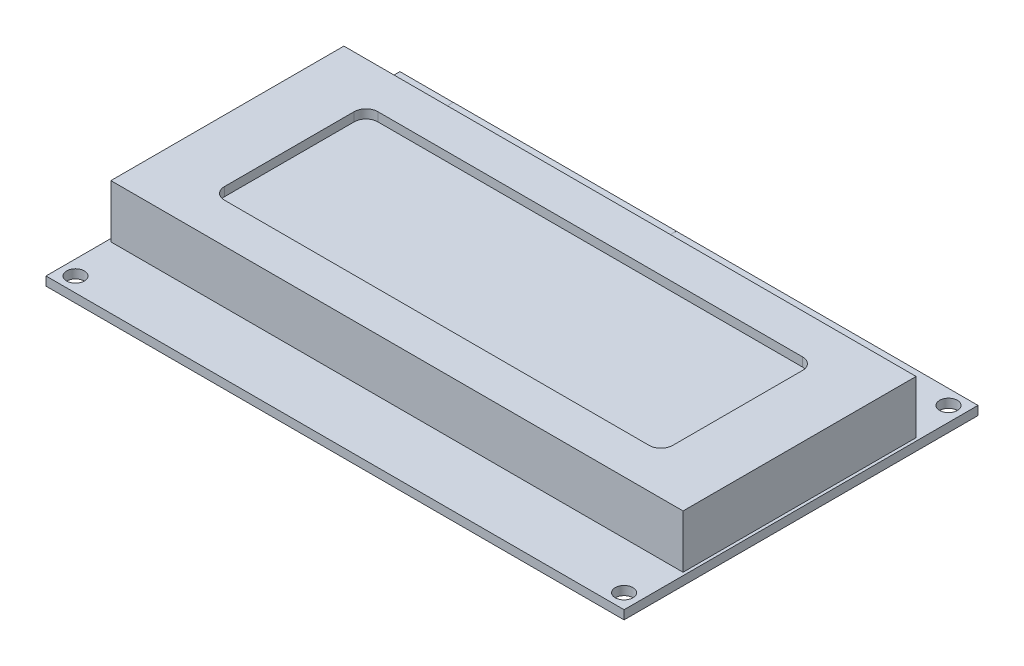
from build123d import *

# Parameters (mm, degrees)
SKETCH1_W           = 98
SKETCH1_H           = 60
BOSS_EXTRUDE1_DEPTH = 1.5
SKETCH2_W           = 97
SKETCH2_H           = 39.5
BOSS_EXTRUDE2_DEPTH = 9
CUT_EXTRUDE1_DEPTH  = 1.5
CUT_EXTRUDE2_REACH  = 60.155
SKETCH4_R           = 1.5
SKETCH5_W           = 37.809406893
SKETCH5_H           = 4.525576916
BOSS_EXTRUDE3_DEPTH = 0.01


with BuildPart() as part:
    # Sketch1 → Boss-Extrude1 (new body)
    with BuildSketch(Plane(origin=(0, 0, 0), x_dir=(1, 0, 0), z_dir=(0, 1, 0))):
        Rectangle(SKETCH1_W, SKETCH1_H)
    extrude(amount=BOSS_EXTRUDE1_DEPTH)

    # Sketch2 → Boss-Extrude2 (add)
    with BuildSketch(Plane(origin=(0, 1.5, 0), x_dir=(1, 0, 0), z_dir=(0, 1, 0))):
        with Locations((0, 0.25)):
            Rectangle(SKETCH2_W, SKETCH2_H)
    extrude(amount=BOSS_EXTRUDE2_DEPTH)

    # Sketch3 → Cut-Extrude1 (cut)
    with BuildSketch(Plane(origin=(0, 10.5, 0), x_dir=(1, 0, 0), z_dir=(0, 1, 0))):
        with BuildLine():
            Line((-36, 13.25), (36, 13.25))
            ThreePointArc((36, 13.25), (37.414213562, 12.664213562), (38, 11.25))
            Line((38, 11.25), (38, -10.75))
            ThreePointArc((38, -10.75), (37.414213562, -12.164213562), (36, -12.75))
            Line((36, -12.75), (-36, -12.75))
            ThreePointArc((-36, -12.75), (-37.414213562, -12.164213562), (-38, -10.75))
            Line((-38, -10.75), (-38, 11.25))
            ThreePointArc((-38, 11.25), (-37.414213562, 12.664213562), (-36, 13.25))
        make_face()
    extrude(amount=-CUT_EXTRUDE1_DEPTH, mode=Mode.SUBTRACT)

    # Sketch4 → Cut-Extrude2 (cut, up to next)
    with BuildSketch(Plane(origin=(0, 1.5, 0), x_dir=(1, 0, 0), z_dir=(0, 1, 0)), mode=Mode.PRIVATE) as cut_extrude2_sk1:
        with Locations(Location((-46.5, 27.5, 0), (0, 0, 270))):
            Circle(SKETCH4_R)
    cut_extrude2_tool1 = extrude(cut_extrude2_sk1.sketch, amount=-CUT_EXTRUDE2_REACH, mode=Mode.PRIVATE) & part.part
    # Sketch4 → Cut-Extrude2 (cut, up to next)
    with BuildSketch(Plane(origin=(0, 1.5, 0), x_dir=(1, 0, 0), z_dir=(0, 1, 0)), mode=Mode.PRIVATE) as cut_extrude2_sk2:
        with Locations(Location((46.5, 27.5, 0), (0, 0, 270))):
            Circle(SKETCH4_R)
    cut_extrude2_tool2 = extrude(cut_extrude2_sk2.sketch, amount=-CUT_EXTRUDE2_REACH, mode=Mode.PRIVATE) & part.part
    # Sketch4 → Cut-Extrude2 (cut, up to next)
    with BuildSketch(Plane(origin=(0, 1.5, 0), x_dir=(1, 0, 0), z_dir=(0, 1, 0)), mode=Mode.PRIVATE) as cut_extrude2_sk3:
        with Locations(Location((46.5, -27.5, 0), (0, 0, 270))):
            Circle(SKETCH4_R)
    cut_extrude2_tool3 = extrude(cut_extrude2_sk3.sketch, amount=-CUT_EXTRUDE2_REACH, mode=Mode.PRIVATE) & part.part
    # Sketch4 → Cut-Extrude2 (cut, up to next)
    with BuildSketch(Plane(origin=(0, 1.5, 0), x_dir=(1, 0, 0), z_dir=(0, 1, 0)), mode=Mode.PRIVATE) as cut_extrude2_sk4:
        with Locations(Location((-46.5, -27.5, 0), (0, 0, 270))):
            Circle(SKETCH4_R)
    cut_extrude2_tool4 = extrude(cut_extrude2_sk4.sketch, amount=-CUT_EXTRUDE2_REACH, mode=Mode.PRIVATE) & part.part
    add(cut_extrude2_tool1.solids().sort_by_distance((-46.5, 1.5, -27.5))[0], mode=Mode.SUBTRACT)
    add(cut_extrude2_tool2.solids().sort_by_distance((46.5, 1.5, -27.5))[0], mode=Mode.SUBTRACT)
    add(cut_extrude2_tool3.solids().sort_by_distance((46.5, 1.5, 27.5))[0], mode=Mode.SUBTRACT)
    add(cut_extrude2_tool4.solids().sort_by_distance((-46.5, 1.5, 27.5))[0], mode=Mode.SUBTRACT)

    # Sketch5 → Boss-Extrude3 (add)
    with BuildSketch(Plane(origin=(0, 1.5, 0), x_dir=(1, 0, 0), z_dir=(0, 1, 0))):
        with Locations((-21.049918021, 27.737211542)):
            Rectangle(SKETCH5_W, SKETCH5_H)
    extrude(amount=BOSS_EXTRUDE3_DEPTH)


solid = part.part
